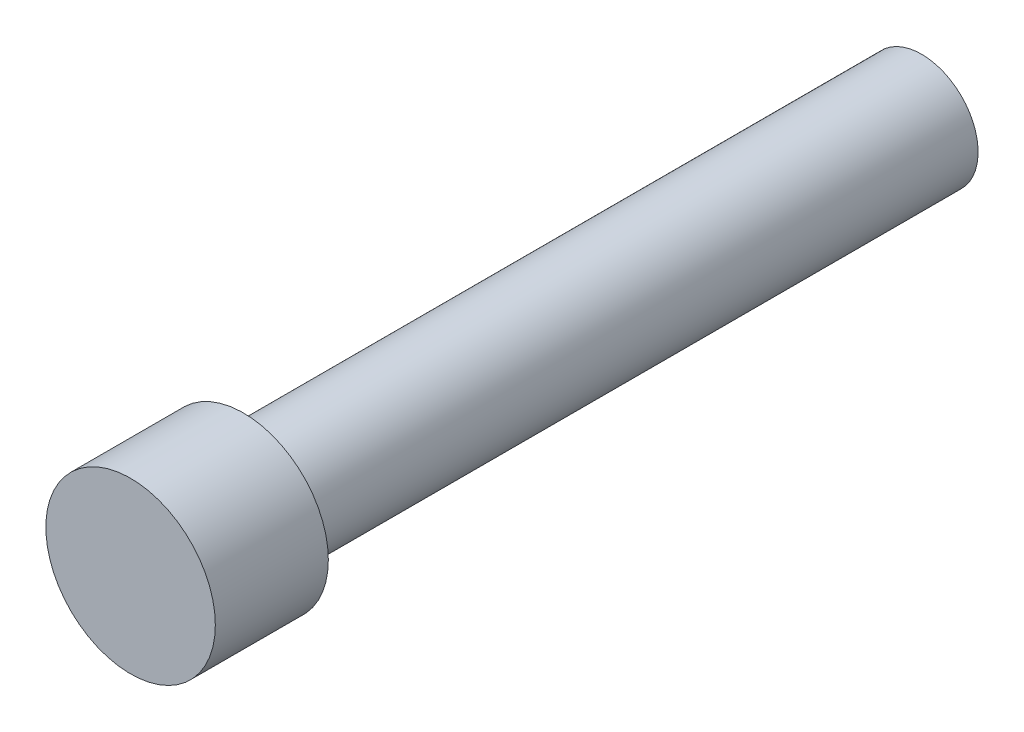
from build123d import *

# Parameters (mm, degrees)
SKETCH_1_R      = 1.5
EXTRUDE_1_DEPTH = 2
SKETCH_2_R      = 1
EXTRUDE_3_DEPTH = 12


with BuildPart() as part:
    # 草图1 → 凸台-拉伸1 (new body)
    with BuildSketch(Plane.XY):
        Circle(SKETCH_1_R)
    extrude(amount=EXTRUDE_1_DEPTH)

    # 草图2 → 凸台-拉伸3 (add)
    with BuildSketch(Plane(origin=(0, 0, 0), x_dir=(-1, 0, 0), z_dir=(0, 0, -1))):
        Circle(SKETCH_2_R)
    extrude(amount=EXTRUDE_3_DEPTH)


solid = part.part
